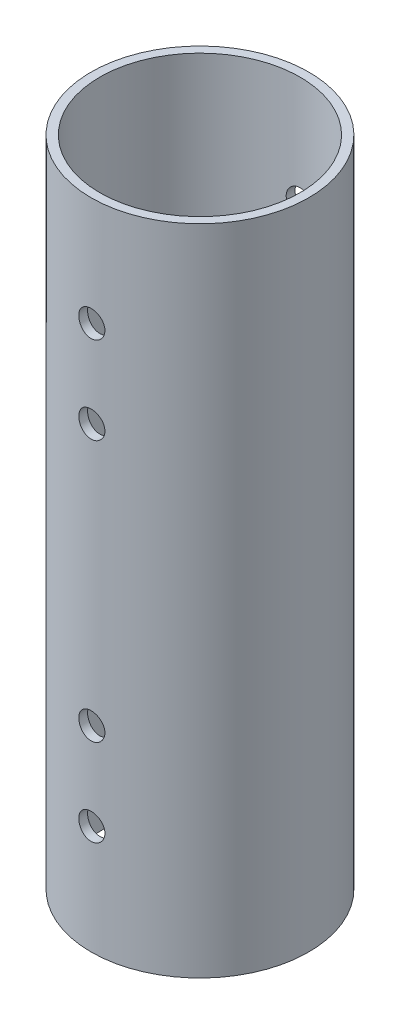
from build123d import *

# Parameters (mm, degrees)
SKETCH_1_R               = 25
SKETCH_1_R_2             = 23
EXTRUDE_1_DEPTH          = 150
CUT_EXTRUDE_2_DEPTH      = 155.110350074
CUT_EXTRUDE_2_DEPTH_BACK = 155.110350074
SKETCH_3_R               = 3


with BuildPart() as part:
    # 草图1 → 凸台-拉伸1 (new body)
    with BuildSketch(Plane(origin=(0, 0, 0), x_dir=(1, 0, 0), z_dir=(0, 1, 0))):
        with Locations(Location((0, 0, 0), (0, 0, 270))):
            Circle(SKETCH_1_R)
        with Locations(Location((0, 0, 0), (0, 0, 270))):
            Circle(SKETCH_1_R_2, mode=Mode.SUBTRACT)
    extrude(amount=EXTRUDE_1_DEPTH)

    # 草图3 → 切除-拉伸2 (cut, two sides: drawn at the far end of the back side and taken through both)
    with BuildSketch(Plane.XY.offset(-CUT_EXTRUDE_2_DEPTH_BACK)):
        with Locations((0, 45)):
            Circle(SKETCH_3_R)
        with Locations((0, 25)):
            Circle(SKETCH_3_R)
        with Locations((0, 125)):
            Circle(SKETCH_3_R)
        with Locations((0, 105)):
            Circle(SKETCH_3_R)
    extrude(amount=CUT_EXTRUDE_2_DEPTH + CUT_EXTRUDE_2_DEPTH_BACK, mode=Mode.SUBTRACT)


solid = part.part
